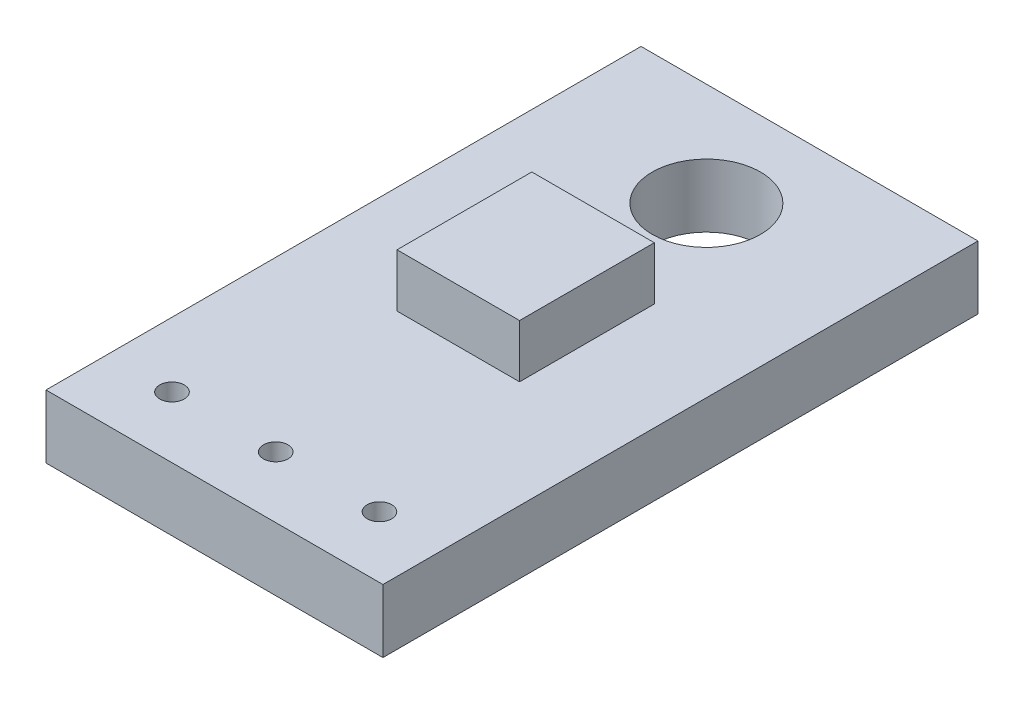
from build123d import *

# Parameters (mm, degrees)
SKETCH1_W                      = 8.25
SKETCH1_H                      = 14.57
BOSS_EXTRUDE1_DEPTH            = 1.55
SKETCH2_R                      = 1.325
CUT_EXTRUDE1_DEPTH             = 17.815168747
SKETCH3_W                      = 3
SKETCH3_H                      = 3.3
BOSS_EXTRUDE2_DEPTH            = 1.3
F_0_6_0_6_DIAMETER_HOLE1_D     = 0.6
F_0_6_0_6_DIAMETER_HOLE1_DEPTH = 2
F_0_6_0_6_DIAMETER_HOLE1_TIP   = 0.180258186


with BuildPart() as part:
    # Sketch1 → Boss-Extrude1 (new body)
    with BuildSketch(Plane(origin=(0, 0, 0), x_dir=(1, 0, 0), z_dir=(0, 1, 0))):
        with Locations((4.125, 7.285)):
            Rectangle(SKETCH1_W, SKETCH1_H)
    extrude(amount=BOSS_EXTRUDE1_DEPTH)

    # Sketch2 → Cut-Extrude1 (cut, through all)
    with BuildSketch(Plane(origin=(0, 1.55, 0), x_dir=(1, 0, 0), z_dir=(0, 1, 0))):
        with Locations(Location((4.125, 12.045, 0), (0, 0, 270))):
            Circle(SKETCH2_R)
    extrude(amount=-CUT_EXTRUDE1_DEPTH, mode=Mode.SUBTRACT)

    # Sketch3 → Boss-Extrude2 (add)
    with BuildSketch(Plane(origin=(0, 1.55, 0), x_dir=(1, 0, 0), z_dir=(0, 1, 0))):
        with Locations((4.125, 7.62)):
            Rectangle(SKETCH3_W, SKETCH3_H)
    extrude(amount=BOSS_EXTRUDE2_DEPTH)

    # Ø0.6 (0.6) Diameter Hole1
    with Locations(Plane(origin=(0, 1.55, 0), x_dir=(1, 0, 0), z_dir=(0, 1, 0))):
        with Locations((4.125, 1.5), (1.585, 1.5), (6.665, 1.5)):
            Hole(F_0_6_0_6_DIAMETER_HOLE1_D / 2, depth=F_0_6_0_6_DIAMETER_HOLE1_DEPTH)
            with Locations((0, 0, -(F_0_6_0_6_DIAMETER_HOLE1_DEPTH + F_0_6_0_6_DIAMETER_HOLE1_TIP / 2))):  # 118° drill point
                Cone(0, F_0_6_0_6_DIAMETER_HOLE1_D / 2, F_0_6_0_6_DIAMETER_HOLE1_TIP, mode=Mode.SUBTRACT)


solid = part.part
